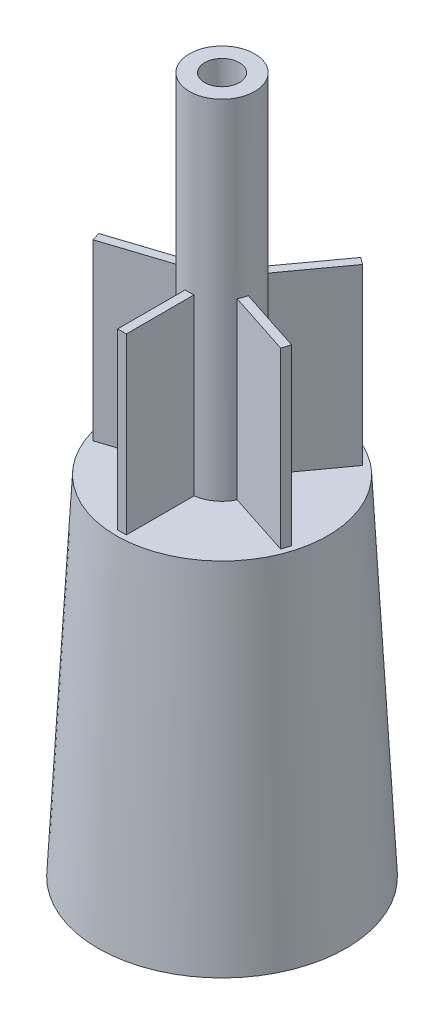
from build123d import *

# Parameters (mm, degrees)
SKETCH1_R          = 2.85
EXTRUDE1_DEPTH     = 8
EXTRUDE1_TAPER     = 3
SHELL1_T           = -0.5
SKETCH3_R          = 0.75
EXTRUDE2_DEPTH     = 8
EXTRUDE3_DEPTH     = 4
SKETCH5_R          = 0.398521604
CUT_EXTRUDE1_DEPTH = 10.407178171


with BuildPart() as part:
    # Sketch1 → Extrude1 (new body)
    with BuildSketch(Plane(origin=(0, 0, 0), x_dir=(1, 0, 0), z_dir=(0, 1, 0))):
        Circle(SKETCH1_R)
    extrude(amount=EXTRUDE1_DEPTH, taper=EXTRUDE1_TAPER)

    # Shell1
    shell1_openings = [part.faces().sort_by_distance(p)[0] for p in [
        (0, 0, 0),
    ]]
    offset(amount=SHELL1_T, openings=shell1_openings, kind=Kind.INTERSECTION)

    # Sketch3 → Extrude2 (add)
    with BuildSketch(Plane(origin=(0, 8, 0), x_dir=(-1, 0, 0), z_dir=(0, 1, 0))):
        with Locations(Location((0, 0, 0), (0, 0, 90))):
            Circle(SKETCH3_R)
    extrude(amount=EXTRUDE2_DEPTH)

    # Sketch4 → Extrude3 (add)
    with BuildSketch(Plane(origin=(0, 8, 0), x_dir=(-1, 0, 0), z_dir=(0, 1, 0))):
        with BuildLine():
            Line((0.664541882, 0.323529903), (2.154187801, 0.807545202))
            Line((2.154187801, 0.807545202), (2.2159912, 0.617333899))
            Line((2.2159912, 0.617333899), (0.7269532, 0.133516124))
            ThreePointArc((0.7269532, 0.133516124), (0.702204351, 0.230643797), (0.664541882, 0.323529903))
        make_face()
        with BuildLine():
            Line((-0.1, 0.732316537), (-0.1, 2.3))
            Line((-0.1, 2.3), (0.1, 2.3))
            Line((0.1, 2.3), (0.1, 0.732316537))
            ThreePointArc((0.1, 0.732316537), (0, 0.739112651), (-0.1, 0.732316537))
        make_face()
        with BuildLine():
            Line((0.512399846, -0.532666789), (1.431361279, -1.797508691))
            Line((1.431361279, -1.797508691), (1.26955788, -1.915065741))
            Line((1.26955788, -1.915065741), (0.350828651, -0.650543441))
            ThreePointArc((0.350828651, -0.650543441), (0.435619772, -0.597095407), (0.512399846, -0.532666789))
        make_face()
        with BuildLine():
            Line((-0.350828651, -0.650543441), (-1.26955788, -1.915065741))
            Line((-1.26955788, -1.915065741), (-1.431361279, -1.797508691))
            Line((-1.431361279, -1.797508691), (-0.512399846, -0.532666789))
            ThreePointArc((-0.512399846, -0.532666789), (-0.435619772, -0.597095407), (-0.350828651, -0.650543441))
        make_face()
        with BuildLine():
            Line((-0.7269532, 0.133516124), (-2.2159912, 0.617333899))
            Line((-2.2159912, 0.617333899), (-2.154187801, 0.807545202))
            Line((-2.154187801, 0.807545202), (-0.664541882, 0.323529903))
            ThreePointArc((-0.664541882, 0.323529903), (-0.702204351, 0.230643797), (-0.7269532, 0.133516124))
        make_face()
    extrude(amount=EXTRUDE3_DEPTH)

    # Sketch5 → Cut-Extrude1 (cut, through all)
    with BuildSketch(Plane.XZ.offset(-7.5)):
        with Locations(Location((0, 0, 0), (0, 0, 270))):
            Circle(SKETCH5_R)
    extrude(amount=-CUT_EXTRUDE1_DEPTH, mode=Mode.SUBTRACT)


solid = part.part
